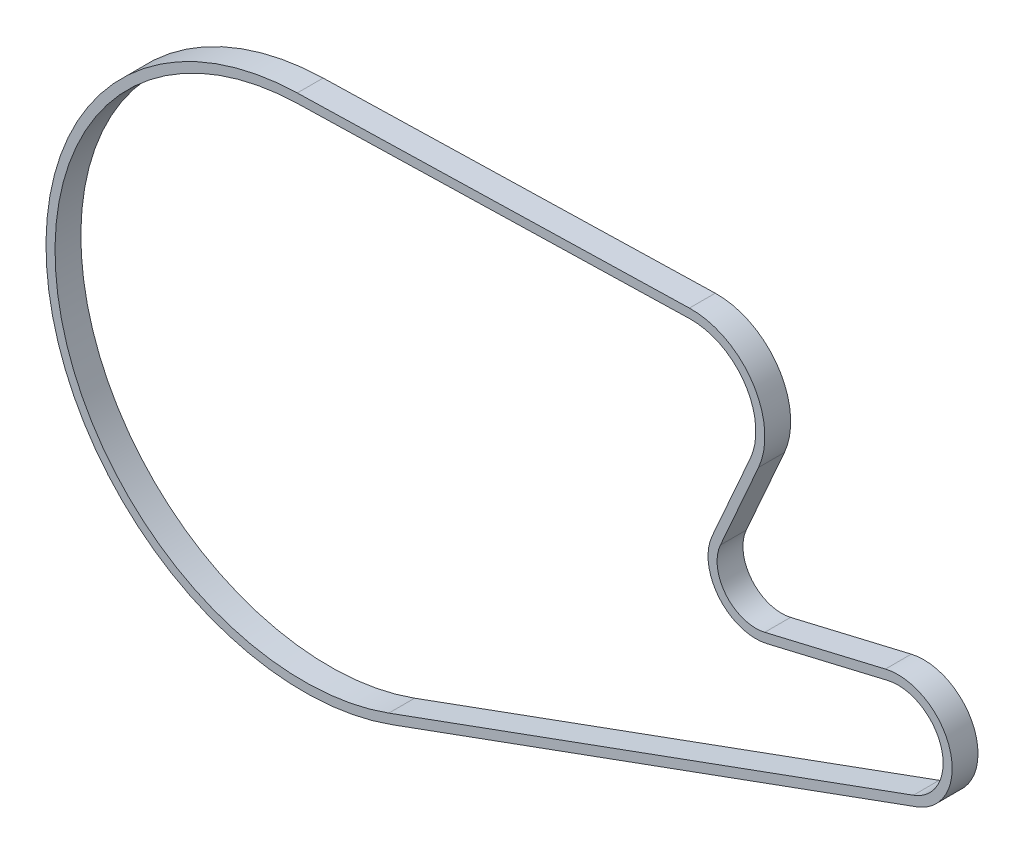
from build123d import *

# Parameters (mm, degrees)
RESSALTO_EXTRUS_O1_DEPTH = 2


with BuildPart() as part:
    # Esboço1 → Ressalto-extrusão1 (new body)
    with BuildSketch(Plane.XY):
        with BuildLine():
            Line((6.830706522, -18.744171052), (47.438043478, -3.946141274))
            ThreePointArc((47.438043478, -3.946141274), (50.023755431, 1.20390707), (45.03438185, 4.087490867))
            Line((45.03438185, 4.087490867), (35.691545582, 1.880363666))
            ThreePointArc((35.691545582, 1.880363666), (32.69418675, 2.883013698), (32.258162325, 6.013405008))
            Line((32.258162325, 6.013405008), (35.212946414, 12.694530484))
            ThreePointArc((35.212946414, 12.694530484), (34.737555331, 18.169474639), (29.858379797, 20.698240405))
            Line((29.858379797, 20.698240405), (-0.49567071, 19.943841419))
            ThreePointArc((-0.49567071, 19.943841419), (-19.601626129, -3.711974283), (6.830706522, -18.744171052))
        make_face()
        with BuildLine():
            Line((45.195318208, 3.406242389), (35.852481941, 1.199115189))
            ThreePointArc((35.852481941, 1.199115189), (32.155739381, 2.435716894), (31.617975923, 6.296532844))
            Line((31.617975923, 6.296532844), (34.572760012, 12.977658319))
            ThreePointArc((34.572760012, 12.977658319), (34.15575029, 17.780240912), (29.875771752, 19.998456496))
            Line((29.875771752, 19.998456496), (-0.478278755, 19.24405751))
            ThreePointArc((-0.478278755, 19.24405751), (-18.913849774, -3.581729572), (6.591032609, -18.086480839))
            Line((6.591032609, -18.086480839), (47.198369565, -3.288451062))
            ThreePointArc((47.198369565, -3.288451062), (49.353129526, 1.003255892), (45.195318208, 3.406242389))
        make_face(mode=Mode.SUBTRACT)
    extrude(amount=RESSALTO_EXTRUS_O1_DEPTH)


solid = part.part
